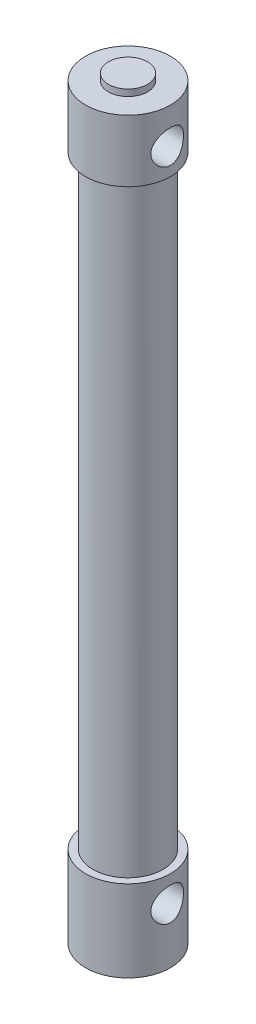
from build123d import *

# Parameters (mm, degrees)
SKETCH_1_R          = 10.75
SKETCH_1_R_2        = 9
EXTRUDE_1_DEPTH     = 185
SKETCH_5_R          = 5
CUT_EXTRUDE_2_DEPTH = 10
SKETCH_6_R          = 1.058948346
CUT_EXTRUDE_3_DEPTH = 15


with BuildPart() as part:
    # 草图1 → 拉伸1 (new body)
    with BuildSketch(Plane(origin=(0, 0, 0), x_dir=(1, 0, 0), z_dir=(0, 1, 0))):
        with Locations(Location((0, 0, 0), (0, 0, 270))):
            Circle(SKETCH_1_R)
        with Locations(Location((0, 0, 0), (0, 0, 270))):
            Circle(SKETCH_1_R_2, mode=Mode.SUBTRACT)
    extrude(amount=EXTRUDE_1_DEPTH)

    # 草图3 → 旋转1 (revolve)
    with BuildSketch(Plane(origin=(0, 0, 0), x_dir=(0, 0, -1), z_dir=(1, 0, 0)), mode=Mode.PRIVATE) as revolve_1_sk:
        Polygon((0, 185), (-13, 185), (-13, 204), (-6, 204), (-6, 206), (0, 206), align=None)
    revolve(revolve_1_sk.sketch.rotate(Axis((0, 185, 0), (0, 1, 0)), 180), axis=Axis((0, 185, 0), (0, 1, 0)))

    # 草图4 → 旋转2 (revolve)
    with BuildSketch(Plane(origin=(0, 0, 0), x_dir=(0, 0, -1), z_dir=(1, 0, 0)), mode=Mode.PRIVATE) as revolve_2_sk:
        Polygon((5, 0), (13, 0), (13, -25), (6, -25), (6, -27), (5, -27), align=None)
    revolve(revolve_2_sk.sketch.rotate(Axis((0, 0, 0), (0, -1, 0)), 180), axis=Axis((0, 0, 0), (0, -1, 0)))

    # 草图5 → 拉伸2 (cut)
    with BuildSketch(Plane(origin=(13, 0, 0), x_dir=(0, 0, -1), z_dir=(1, 0, 0))):
        with Locations((0, 193)):
            Circle(SKETCH_5_R)
        with Locations((0, -8)):
            Circle(SKETCH_5_R)
    extrude(amount=-CUT_EXTRUDE_2_DEPTH, mode=Mode.SUBTRACT)

    # 草图6 → 拉伸3 (cut)
    with BuildSketch(Plane.XZ.offset(25)):
        with Locations(Location((7, 7, 0), (0, 0, 270))):
            Circle(SKETCH_6_R)
        with Locations(Location((-7, 7, 0), (0, 0, 270))):
            Circle(SKETCH_6_R)
        with Locations(Location((-7, -7, 0), (0, 0, 270))):
            Circle(SKETCH_6_R)
        with Locations(Location((7, -7, 0), (0, 0, 270))):
            Circle(SKETCH_6_R)
    extrude(amount=-CUT_EXTRUDE_3_DEPTH, mode=Mode.SUBTRACT)


solid = part.part
